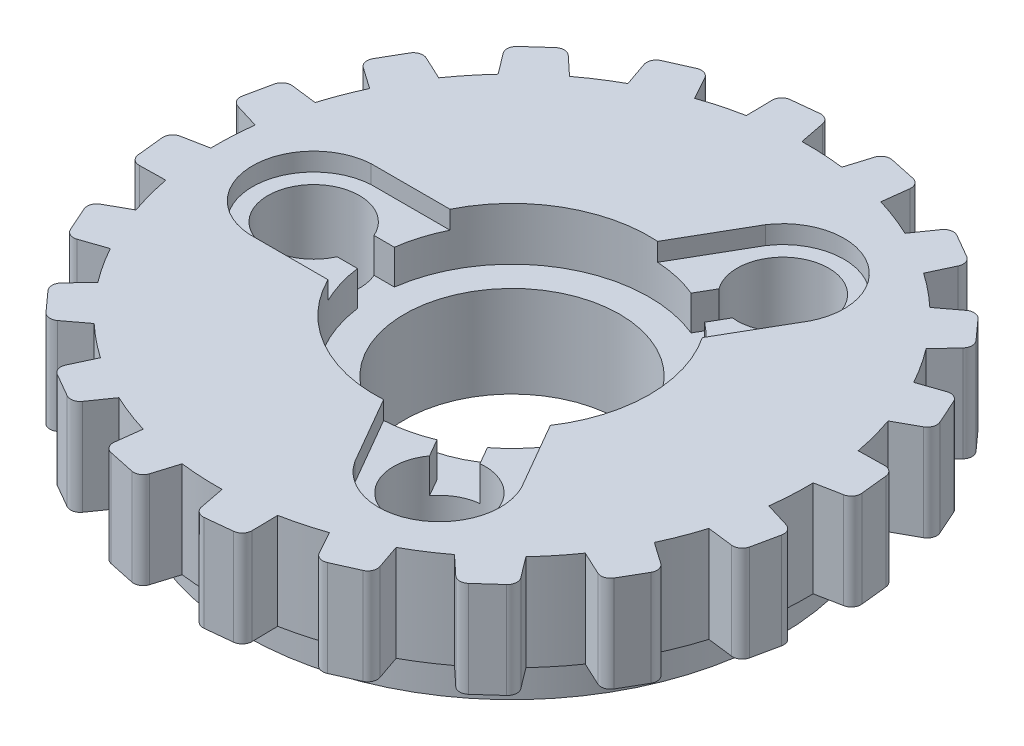
from build123d import *
from build123d.topology import SkipClean

# Parameters (mm, degrees)
SKETCH2_R           = 30.76400007
SKETCH2_R_2         = 4.7625
SKETCH2_R_3         = 11.2
BOSS_EXTRUDE2_DEPTH = 10
BOSS_EXTRUDE3_START = 5
SKETCH4_R           = 27.7625
SKETCH4_R_2         = 4.7625
SKETCH4_R_3         = 11.2
BOSS_EXTRUDE3_DEPTH = 5
CUT_EXTRUDE4_START  = -1.8875
CUT_EXTRUDE4_DEPTH  = 1.8875
CUT_EXTRUDE7_START  = -5.48
CUT_EXTRUDE7_DEPTH  = 5.48
BOSS_EXTRUDE4_START = -10
BOSS_EXTRUDE4_DEPTH = 10
CIRPATTERN1_COUNT   = 20


with BuildPart() as part:
    # Sketch2 → Boss-Extrude2 (new body)
    with BuildSketch(Plane(origin=(0, 0, 0), x_dir=(1, 0, 0), z_dir=(0, 1, 0))):
        with Locations(Location((0, 0, 0), (0, 0, 270))):
            Circle(SKETCH2_R)
        with Locations(Location((-20.6375, 0, 0), (0, 0, 270))):
            Circle(SKETCH2_R_2, mode=Mode.SUBTRACT)
        with Locations(Location((10.31875, 17.872599271, 0), (0, 0, 270))):
            Circle(SKETCH2_R_2, mode=Mode.SUBTRACT)
        with Locations(Location((10.31875, -17.872599271, 0), (0, 0, 270))):
            Circle(SKETCH2_R_2, mode=Mode.SUBTRACT)
        with Locations(Location((0, 0, 0), (0, 0, 270))):
            Circle(SKETCH2_R_3, mode=Mode.SUBTRACT)
    extrude(amount=BOSS_EXTRUDE2_DEPTH)

    # Sketch4 → Boss-Extrude3 (add)
    with SkipClean():  # the faces are left unmerged after this step: merging them gives an invalid solid
        with BuildSketch(Plane.XZ.offset(BOSS_EXTRUDE3_START)):
            with Locations(Location((0, 0, 0), (0, 0, 90))):
                Circle(SKETCH4_R)
            with Locations(Location((10.31875, -17.872599271, 0), (0, 0, 270))):
                Circle(SKETCH4_R_2, mode=Mode.SUBTRACT)
            with Locations(Location((10.31875, 17.872599271, 0), (0, 0, 270))):
                Circle(SKETCH4_R_2, mode=Mode.SUBTRACT)
            with Locations(Location((0, 0, 0), (0, 0, 270))):
                Circle(SKETCH4_R_3, mode=Mode.SUBTRACT)
            with Locations(Location((-20.6375, 0, 0), (0, 0, 270))):
                Circle(SKETCH4_R_2, mode=Mode.SUBTRACT)
        extrude(amount=-BOSS_EXTRUDE3_DEPTH)

    # Sketch5 → Cut-Extrude4 (cut)
    with SkipClean():  # the faces are left unmerged after this step: merging them gives an invalid solid
        with BuildSketch(Plane(origin=(0, 10, 0), x_dir=(1, 0, 0), z_dir=(0, 1, 0)).offset(CUT_EXTRUDE4_START)):
            with BuildLine():
                Line((-21, 6.35), (-9.225914589, 6.35))
                ThreePointArc((-9.225914589, 6.35), (-11.2, 0), (-9.225914589, -6.35))
                Line((-9.225914589, -6.35), (-21, -6.35))
                ThreePointArc((-21, -6.35), (-26.997838533, 0), (-21, 6.35))
            make_face()
            with BuildLine():
                Line((5.000738686, 21.361533479), (-0.88630402, 11.164876407))
                ThreePointArc((-0.88630402, 11.164876407), (5.6, 9.699484522), (10.112218608, 4.814876407))
                Line((10.112218608, 4.814876407), (15.999261314, 15.011533479))
                ThreePointArc((15.999261314, 15.011533479), (13.498919266, 23.380814017), (5.000738686, 21.361533479))
            make_face()
            with BuildLine():
                Line((15.999261314, -15.011533479), (10.112218608, -4.814876407))
                ThreePointArc((10.112218608, -4.814876407), (5.6, -9.699484522), (-0.88630402, -11.164876407))
                Line((-0.88630402, -11.164876407), (5.000738686, -21.361533479))
                ThreePointArc((5.000738686, -21.361533479), (13.498919266, -23.380814017), (15.999261314, -15.011533479))
            make_face()
        extrude(amount=CUT_EXTRUDE4_DEPTH, mode=Mode.SUBTRACT)

    # Sketch7 → Cut-Extrude7 (cut)
    with BuildSketch(Plane(origin=(0, 10, 0), x_dir=(1, 0, 0), z_dir=(0, 1, 0)).offset(CUT_EXTRUDE7_START)):
        with BuildLine():
            Line((5.416183411, 13.221104852), (6.476818183, 15.058178164))
            ThreePointArc((6.476818183, 15.058178164), (7.9375, 13.748153285), (9.802355734, 13.138178164))
            Line((9.802355734, 13.138178164), (8.741720962, 11.301104852))
            ThreePointArc((8.741720962, 11.301104852), (14.2875, 0), (8.741720962, -11.301104852))
            Line((8.741720962, -11.301104852), (9.802355734, -13.138178164))
            ThreePointArc((9.802355734, -13.138178164), (7.9375, -13.748153285), (6.476818183, -15.058178164))
            Line((6.476818183, -15.058178164), (5.416183411, -13.221104852))
            ThreePointArc((5.416183411, -13.221104852), (-7.14375, -12.373337957), (-14.157904374, -1.92))
            Line((-14.157904374, -1.92), (-16.279173917, -1.92))
            ThreePointArc((-16.279173917, -1.92), (-15.875, 0), (-16.279173917, 1.92))
            Line((-16.279173917, 1.92), (-14.157904374, 1.92))
            ThreePointArc((-14.157904374, 1.92), (-7.14375, 12.373337957), (5.416183411, 13.221104852))
        make_face()
    extrude(amount=CUT_EXTRUDE7_DEPTH, mode=Mode.SUBTRACT)

    # Sketch8 → Boss-Extrude4 (add)
    with BuildSketch(Plane(origin=(0, 10, 0), x_dir=(1, 0, 0), z_dir=(0, 1, 0)).offset(BOSS_EXTRUDE4_START)):
        with BuildLine():
            Line((14.601129327, 30.080631625), (13.046605608, 27.860541675))
            ThreePointArc((13.046605608, 27.860541675), (15.382000035, 26.642405583), (17.604634049, 25.228962727))
            Line((17.604634049, 25.228962727), (18.750026486, 27.685264734))
            ThreePointArc((18.750026486, 27.685264734), (18.797435649, 28.408588795), (18.343718699, 28.973908399))
            Line((18.343718699, 28.973908399), (15.920281371, 30.373080593))
            ThreePointArc((15.920281371, 30.373080593), (15.203841757, 30.483351196), (14.601129327, 30.080631625))
        make_face()
    boss_extrude4 = extrude(amount=BOSS_EXTRUDE4_DEPTH)

    # CirPattern1: Boss-Extrude4 ×20 about axis
    cirpattern1_axis = Axis((0, 0, 0), (0, 1, 0))
    for i in range(1, CIRPATTERN1_COUNT):
        add(boss_extrude4.rotate(cirpattern1_axis, i * 360 / CIRPATTERN1_COUNT))


solid = part.part
